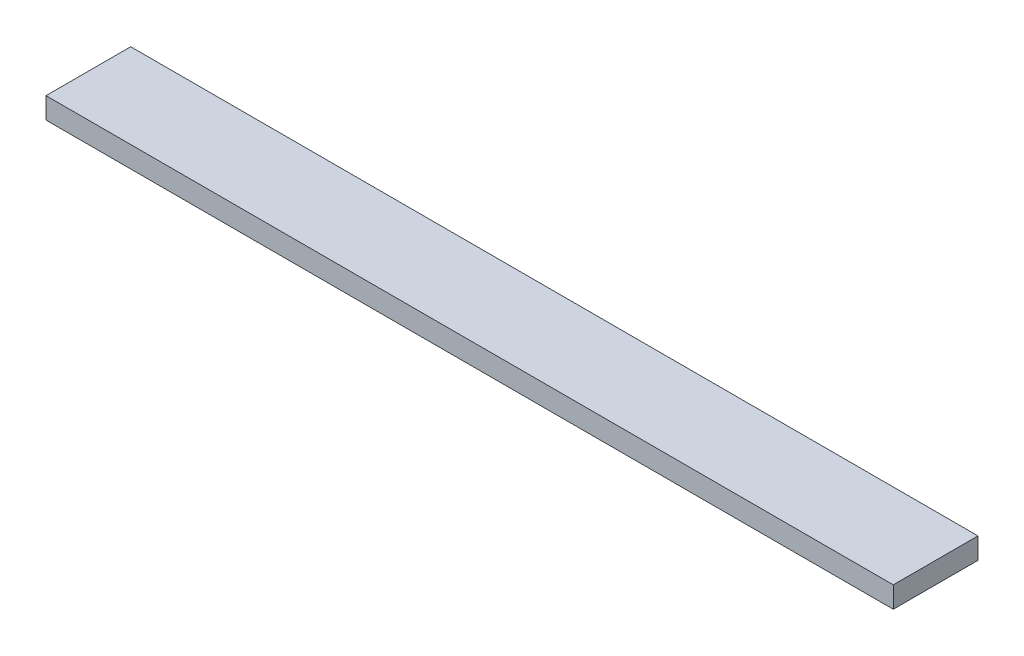
from build123d import *

# Parameters (mm, degrees)
SKETCH1_W           = 400
SKETCH1_H           = 10
BOSS_EXTRUDE1_DEPTH = 40


with BuildPart() as part:
    # Sketch1 → Boss-Extrude1 (new body)
    with BuildSketch(Plane.XY):
        with Locations((0, 195)):
            Rectangle(SKETCH1_W, SKETCH1_H)
    extrude(amount=BOSS_EXTRUDE1_DEPTH)


solid = part.part
